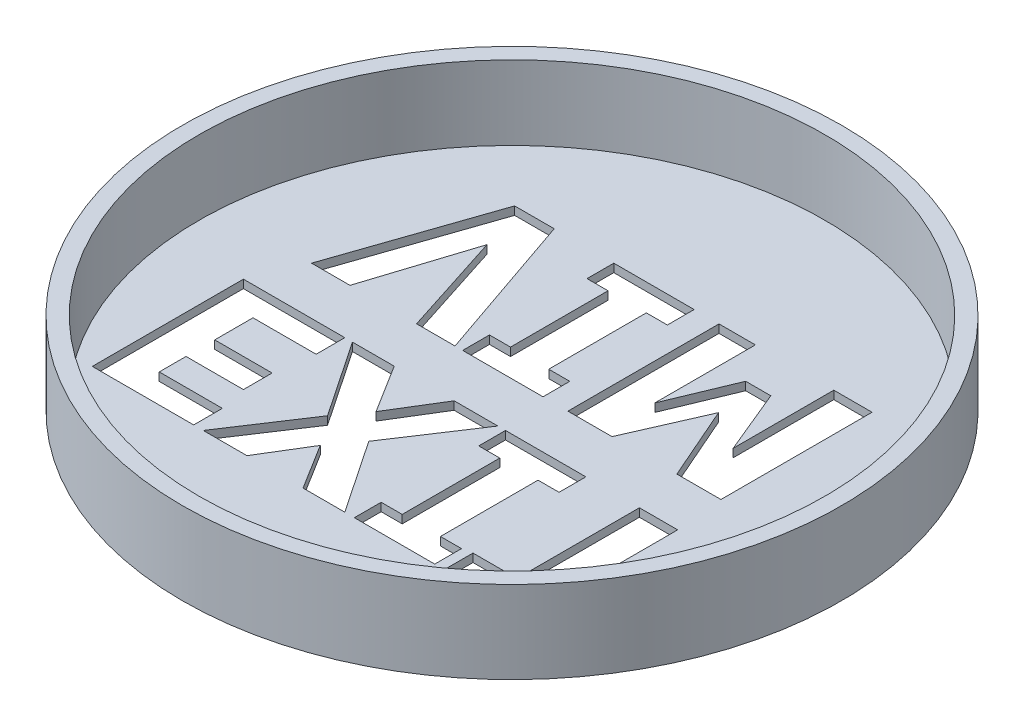
from build123d import *

# Parameters (mm, degrees)
SKETCH1_R           = 40
BOSS_EXTRUDE1_DEPTH = 10
SKETCH2_R           = 38
CUT_EXTRUDE1_DEPTH  = 9
CUT_EXTRUDE2_DEPTH  = 8


with BuildPart() as part:
    # Sketch1 → Boss-Extrude1 (new body)
    with BuildSketch(Plane(origin=(0, 0, 0), x_dir=(1, 0, 0), z_dir=(0, 1, 0))):
        with Locations(Location((0, 0, 0), (0, 0, 270))):
            Circle(SKETCH1_R)
    extrude(amount=BOSS_EXTRUDE1_DEPTH)

    # Sketch2 → Cut-Extrude1 (cut)
    with BuildSketch(Plane(origin=(0, 10, 0), x_dir=(1, 0, 0), z_dir=(0, 1, 0))):
        with Locations(Location((0, 0, 0), (0, 0, 270))):
            Circle(SKETCH2_R)
    extrude(amount=-CUT_EXTRUDE1_DEPTH, mode=Mode.SUBTRACT)

    # Sketch4 → Cut-Extrude2 (cut)
    with BuildSketch(Plane.XZ):
        Polygon((-29.11512784, 3.483476928), (-29.11512784, 21.826543334), (-16.809019998, 21.826543334), (-16.809019998, 18.343682624), (-24.47131356, 18.343682624), (-24.47131356, 15.093012628), (-17.50559214, 15.093012628), (-17.50559214, 11.610151918), (-24.47131356, 11.610151918), (-24.47131356, 6.966337638), (-16.809019998, 6.966337638), (-16.809019998, 3.483476928), align=None)
        Polygon((1.766237122, 3.483476928), (-3.537869501, 3.483476928), (-7.140453548, 9.357176396), (-10.811969213, 3.483476928), (-15.880257142, 3.483476928), (-9.651015643, 12.738453669), (-15.648066428, 21.826543334), (-10.347587785, 21.826543334), (-6.973566472, 16.297501957), (-3.534241521, 21.826543334), (1.534046408, 21.826543334), (-4.463004377, 12.919852664), align=None)
        Polygon((12.447009966, 3.483476928), (2.694999978, 3.483476928), (2.694999978, 6.734146924), (5.249097832, 6.734146924), (5.249097832, 18.575873338), (2.694999978, 18.575873338), (2.694999978, 21.826543334), (12.447009966, 21.826543334), (12.447009966, 18.575873338), (9.892912112, 18.575873338), (9.892912112, 6.734146924), (12.447009966, 6.734146924), align=None)
        Polygon((18.948349958, 3.483476928), (18.948349958, 18.343682624), (13.607963536, 18.343682624), (13.607963536, 21.826543334), (28.93255066, 21.826543334), (28.93255066, 18.343682624), (23.592164238, 18.343682624), (23.592164238, 3.483476928), align=None)
        Polygon((-9.246875158, -2.330611882), (-15.552304236, -20.673678288), (-20.355749631, -20.673678288), (-26.661178709, -2.330611882), (-21.995596549, -2.330611882), (-17.957654913, -14.923330137), (-13.912457318, -2.330611882), align=None)
        Polygon((1.433897686, -20.673678288), (-8.318112302, -20.673678288), (-8.318112302, -17.423008292), (-5.764014448, -17.423008292), (-5.764014448, -5.581281878), (-8.318112302, -5.581281878), (-8.318112302, -2.330611882), (1.433897686, -2.330611882), (1.433897686, -5.581281878), (-1.120200168, -5.581281878), (-1.120200168, -17.423008292), (1.433897686, -17.423008292), align=None)
        Polygon((23.027634088, -20.673678288), (18.383819808, -20.673678288), (18.383819808, -8.469153883), (15.147661732, -16.262054722), (12.10015861, -16.262054722), (8.864000534, -8.469153883), (8.864000534, -20.673678288), (4.452376968, -20.673678288), (4.452376968, -2.330611882), (9.807275309, -2.330611882), (13.750889468, -11.32074609), (17.679991706, -2.330611882), (23.027634088, -2.330611882), align=None)
    extrude(amount=-CUT_EXTRUDE2_DEPTH, mode=Mode.SUBTRACT)


solid = part.part
